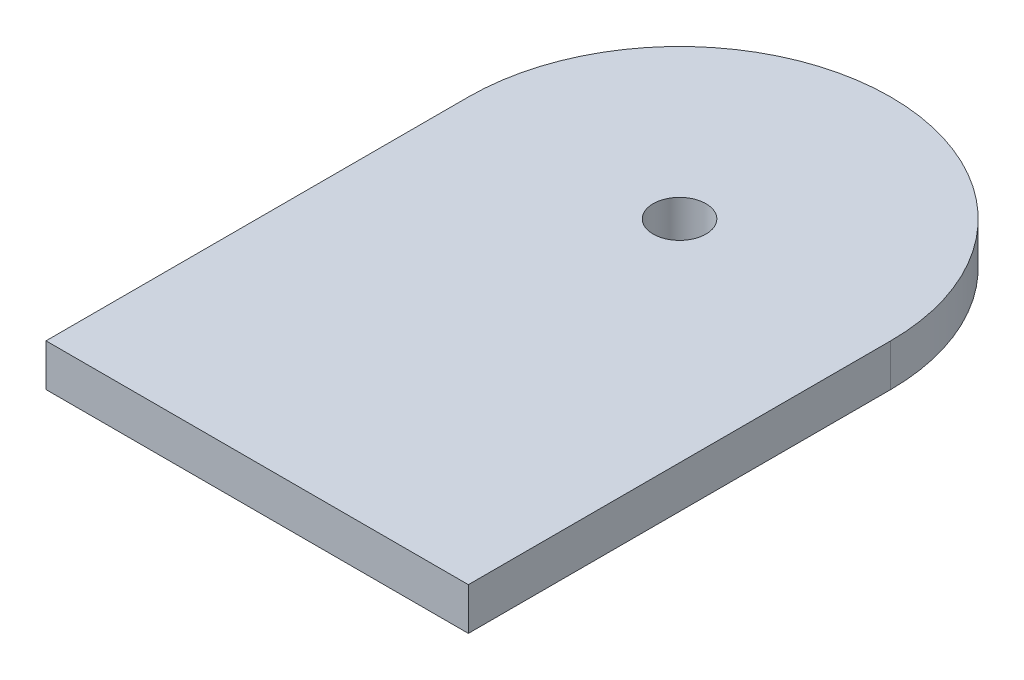
from build123d import *

# Parameters (mm, degrees)
SKETCH1_R           = 5
BOSS_EXTRUDE1_DEPTH = 8


with BuildPart() as part:
    # Sketch1 → Boss-Extrude1 (new body)
    with BuildSketch(Plane(origin=(0, 0, 0), x_dir=(1, 0, 0), z_dir=(0, 1, 0))):
        with BuildLine():
            Line((0, 0), (80, 0))
            Line((80, 0), (80, 80))
            ThreePointArc((80, 80), (40, 120), (0, 80))
            Line((0, 80), (0, 0))
        make_face()
        with Locations(Location((40, 80, 0), (0, 0, 270))):
            Circle(SKETCH1_R, mode=Mode.SUBTRACT)
    extrude(amount=BOSS_EXTRUDE1_DEPTH)


solid = part.part
